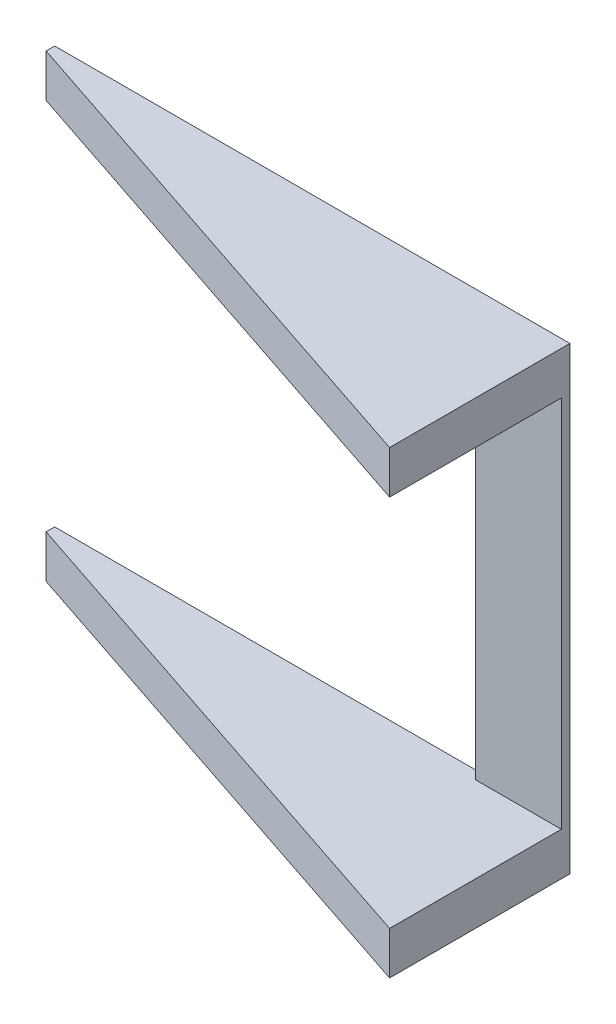
from build123d import *

# Parameters (mm, degrees)
BOSS_EXTRUDE1_DEPTH = 2
BOSS_EXTRUDE2_DEPTH = 10
BOSS_EXTRUDE3_START = -107
BOSS_EXTRUDE3_DEPTH = 10


with BuildPart() as part:
    # Sketch1 → Boss-Extrude1 (new body)
    with BuildSketch(Plane.XY):
        Polygon((-33.541898883, 109.937648966), (-33.541898883, 2.937648966), (-153.541898883, 2.937648966), (-153.541898883, 12.937648966), (-53.541898883, 12.937648966), (-53.541898883, 99.937648966), (-153.541898883, 99.937648966), (-153.541898883, 109.937648966), align=None)
    extrude(amount=BOSS_EXTRUDE1_DEPTH)

    # Sketch2 → Boss-Extrude2 (add)
    with BuildSketch(Plane(origin=(0, 109.937648966, 0), x_dir=(1, 0, 0), z_dir=(0, 1, 0))):
        Polygon((-153.541898883, -2), (-33.541898883, -2), (-33.541898883, -42), align=None)
    extrude(amount=-BOSS_EXTRUDE2_DEPTH)

    # Sketch2<2> → Boss-Extrude3 (add)
    with BuildSketch(Plane(origin=(0, 109.937648966, 0), x_dir=(1, 0, 0), z_dir=(0, 1, 0)).offset(BOSS_EXTRUDE3_START)):
        Polygon((-153.541898883, -2), (-33.541898883, -2), (-33.541898883, -42), align=None)
    extrude(amount=BOSS_EXTRUDE3_DEPTH)


solid = part.part
